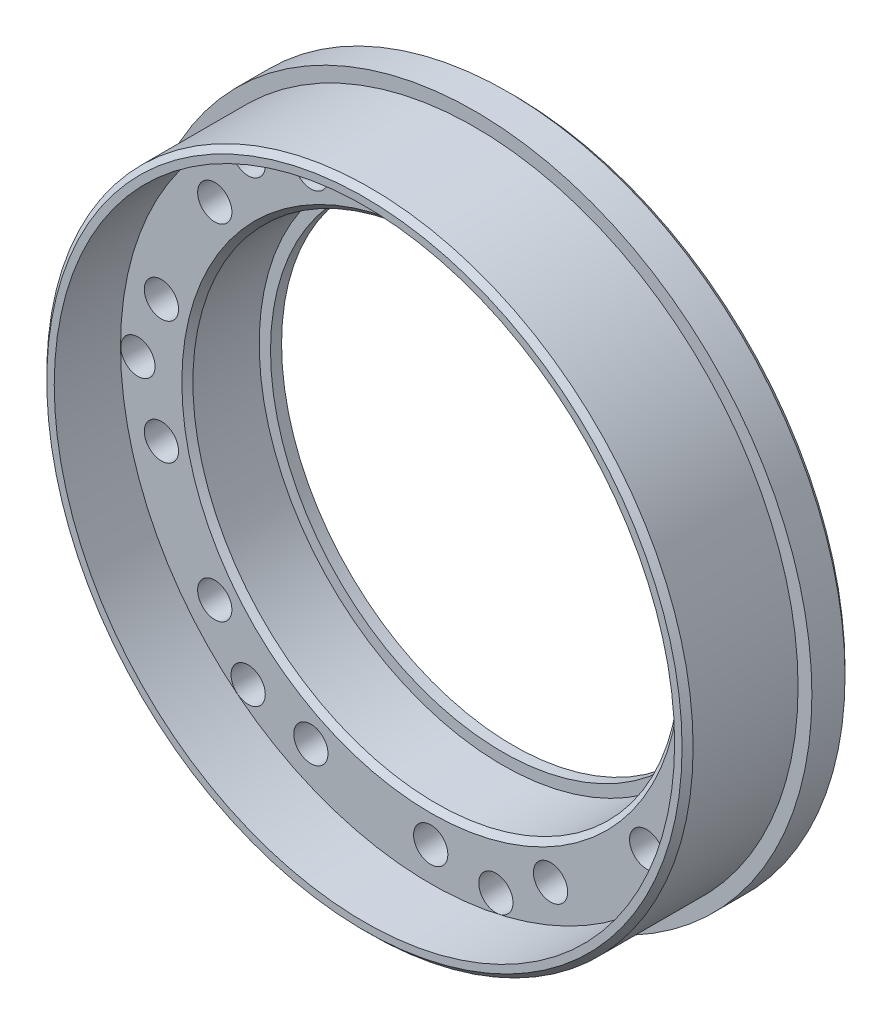
from build123d import *

# Parameters (mm, degrees)
SKETCH1_R           = 30.5
SKETCH1_R_2         = 22.025
BOSS_EXTRUDE1_DEPTH = 3.5
LAPVSROTOR_START    = 3.5
SKETCH1_8_R         = 29.25
SKETCH1_8_R_2       = 22.025
LAPVSROTOR_DEPTH    = 10
CUT_EXTRUDE1_START  = 13.5
SKETCH1_9_R         = 1.55
CUT_EXTRUDE1_DEPTH  = 10
SKETCH2_R           = 22.05
SKETCH2_R_2         = 21
BOSS_EXTRUDE3_DEPTH = 1
SKETCH3_R           = 1.55
CUT_EXTRUDE2_DEPTH  = 46.196791922
CUT_EXTRUDE3_START  = 7.5
SKETCH4_R           = 28.075
SKETCH4_R_2         = 21
CUT_EXTRUDE3_DEPTH  = 6
SKETCH5_R           = 3
CUT_EXTRUDE4_DEPTH  = 2.5
CHAMFER1_SIZE       = 0.5
CIRPATTERN1_COUNT   = 7


with BuildPart() as part:
    # Sketch1 → Boss-Extrude1 (new body)
    with BuildSketch(Plane.XY):
        Circle(SKETCH1_R)
        Circle(SKETCH1_R_2, mode=Mode.SUBTRACT)
    extrude(amount=BOSS_EXTRUDE1_DEPTH)

    # Sketch1<8> → lapvsrotor (add)
    with BuildSketch(Plane.XY.offset(LAPVSROTOR_START)):
        Circle(SKETCH1_8_R)
        Circle(SKETCH1_8_R_2, mode=Mode.SUBTRACT)
    extrude(amount=LAPVSROTOR_DEPTH)

    # Sketch1<9> → Cut-Extrude1 (cut)
    with BuildSketch(Plane.XY.offset(CUT_EXTRUDE1_START)):
        with Locations((0, 25)):
            Circle(SKETCH1_9_R)
        with Locations((10.847093478, 22.524221698)):
            Circle(SKETCH1_9_R)
        with Locations((19.545787062, 15.587245046)):
            Circle(SKETCH1_9_R)
        with Locations((24.373197805, 5.563023349)):
            Circle(SKETCH1_9_R)
        with Locations((24.373197805, -5.563023349)):
            Circle(SKETCH1_9_R)
        with Locations((19.545787062, -15.587245046)):
            Circle(SKETCH1_9_R)
        with Locations((10.847093478, -22.524221698)):
            Circle(SKETCH1_9_R)
        with Locations((0, -25)):
            Circle(SKETCH1_9_R)
        with Locations((-10.847093478, -22.524221698)):
            Circle(SKETCH1_9_R)
        with Locations((-19.545787062, -15.587245046)):
            Circle(SKETCH1_9_R)
        with Locations((-24.373197805, -5.563023349)):
            Circle(SKETCH1_9_R)
        with Locations((-24.373197805, 5.563023349)):
            Circle(SKETCH1_9_R)
        with Locations((-19.545787062, 15.587245046)):
            Circle(SKETCH1_9_R)
        with Locations((-10.847093478, 22.524221698)):
            Circle(SKETCH1_9_R)
    extrude(amount=-CUT_EXTRUDE1_DEPTH, mode=Mode.SUBTRACT)

    # Sketch2 → Boss-Extrude3 (add)
    with BuildSketch(Plane.XY):
        Circle(SKETCH2_R)
        Circle(SKETCH2_R_2, mode=Mode.SUBTRACT)
    extrude(amount=BOSS_EXTRUDE3_DEPTH)

    # Sketch3 → Cut-Extrude2 (cut, through all)
    with BuildSketch(Plane.XY):
        with Locations((5.89680475, 25.835589673)):
            Circle(SKETCH3_R)
        with Locations((23.875674999, 11.497919087)):
            Circle(SKETCH3_R)
        with Locations((23.875674999, -11.497919087)):
            Circle(SKETCH3_R)
        with Locations((5.89680475, -25.835589673)):
            Circle(SKETCH3_R)
        with Locations((-16.522479749, -20.718534285)):
            Circle(SKETCH3_R)
        with Locations((-26.5, 0)):
            Circle(SKETCH3_R)
        with Locations((-16.522479749, 20.718534285)):
            Circle(SKETCH3_R)
    extrude(amount=CUT_EXTRUDE2_DEPTH, mode=Mode.SUBTRACT)

    # Sketch4 → Cut-Extrude3 (cut)
    with BuildSketch(Plane.XY.offset(CUT_EXTRUDE3_START)):
        Circle(SKETCH4_R)
        Circle(SKETCH4_R_2, mode=Mode.SUBTRACT)
    extrude(amount=CUT_EXTRUDE3_DEPTH, mode=Mode.SUBTRACT)

    # Sketch5 → Cut-Extrude4 (cut)
    with BuildSketch(Plane.XY):
        with Locations((5.89680475, 25.835589673)):
            Circle(SKETCH5_R)
    cut_extrude4 = extrude(amount=CUT_EXTRUDE4_DEPTH, mode=Mode.SUBTRACT)

    # Chamfer1
    chamfer1_edges = [part.edges().sort_by_distance(p)[0] for p in [
        (-22.025, 0, 7.5),
        (-30.5, 0, 0),
        (-29.25, 0, 13.5),
    ]]
    chamfer(chamfer1_edges, length=CHAMFER1_SIZE)

    # CirPattern1: Cut-Extrude4 ×7 about axis
    cirpattern1_axis = Axis((0, 0, 0), (0, 0, 1))
    for i in range(1, CIRPATTERN1_COUNT):
        add(cut_extrude4.rotate(cirpattern1_axis, i * 360 / CIRPATTERN1_COUNT), mode=Mode.SUBTRACT)


solid = part.part
